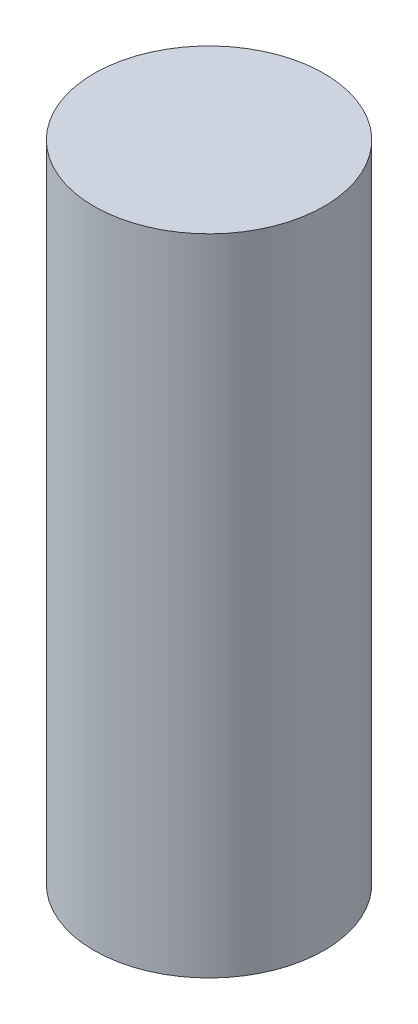
from build123d import *

# Parameters (mm, degrees)
SKETCH1_R           = 2.5
BOSS_EXTRUDE1_DEPTH = 14


with BuildPart() as part:
    # Sketch1 → Boss-Extrude1 (new body)
    with BuildSketch(Plane(origin=(0, 0, 0), x_dir=(1, 0, 0), z_dir=(0, 1, 0))):
        with Locations(Location((0, 0, 0), (0, 0, 270))):
            Circle(SKETCH1_R)
    extrude(amount=BOSS_EXTRUDE1_DEPTH)


solid = part.part
